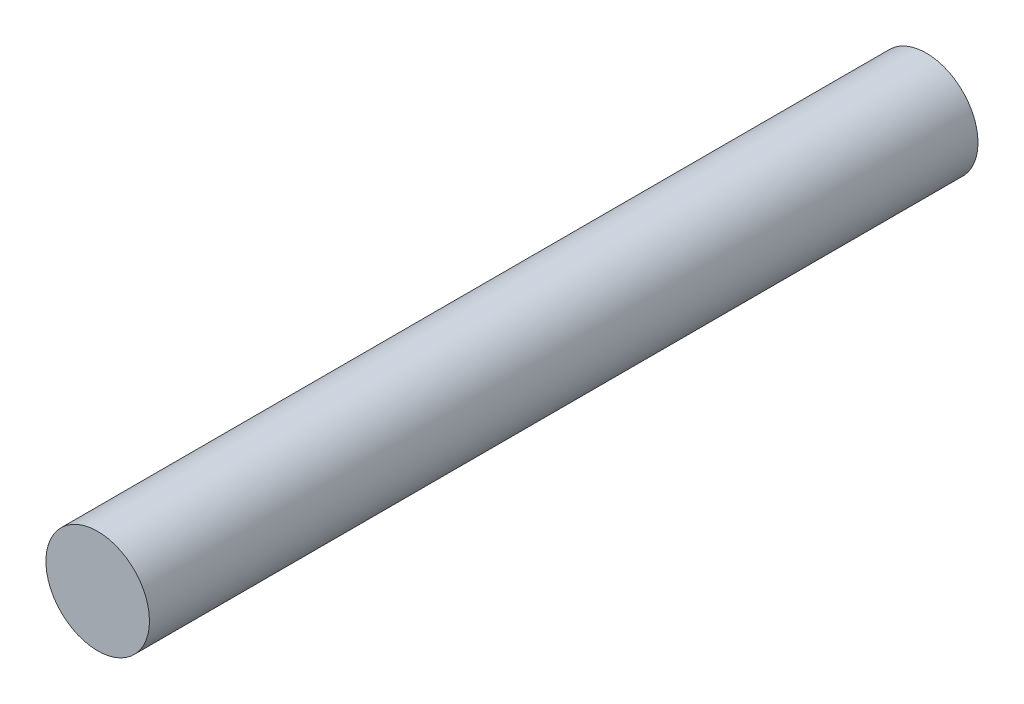
from build123d import *

# Parameters (mm, degrees)
SKETCH1_R           = 1.5875
BOSS_EXTRUDE1_DEPTH = 25.4


with BuildPart() as part:
    # Sketch1 → Boss-Extrude1 (new body)
    with BuildSketch(Plane.XY):
        Circle(SKETCH1_R)
    extrude(amount=-BOSS_EXTRUDE1_DEPTH)


solid = part.part
